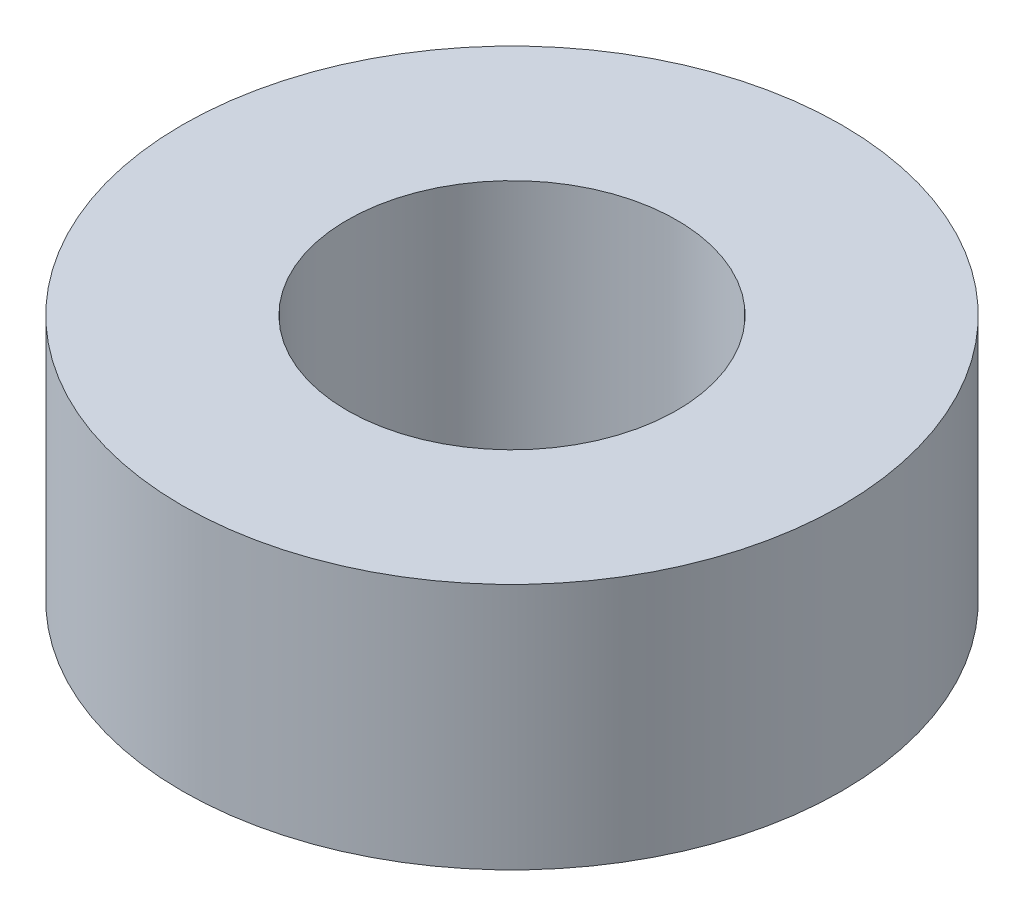
from build123d import *

# Parameters (mm, degrees)
SKETCH_1_R      = 6
SKETCH_1_R_2    = 3
EXTRUDE_1_DEPTH = 4.5


with BuildPart() as part:
    # 草图1 → 凸台-拉伸1 (new body)
    with BuildSketch(Plane(origin=(0, 0, 0), x_dir=(1, 0, 0), z_dir=(0, 1, 0))):
        with Locations(Location((0, 0, 0), (0, 0, 270))):
            Circle(SKETCH_1_R)
        with Locations(Location((0, 0, 0), (0, 0, 270))):
            Circle(SKETCH_1_R_2, mode=Mode.SUBTRACT)
    extrude(amount=EXTRUDE_1_DEPTH)


solid = part.part
